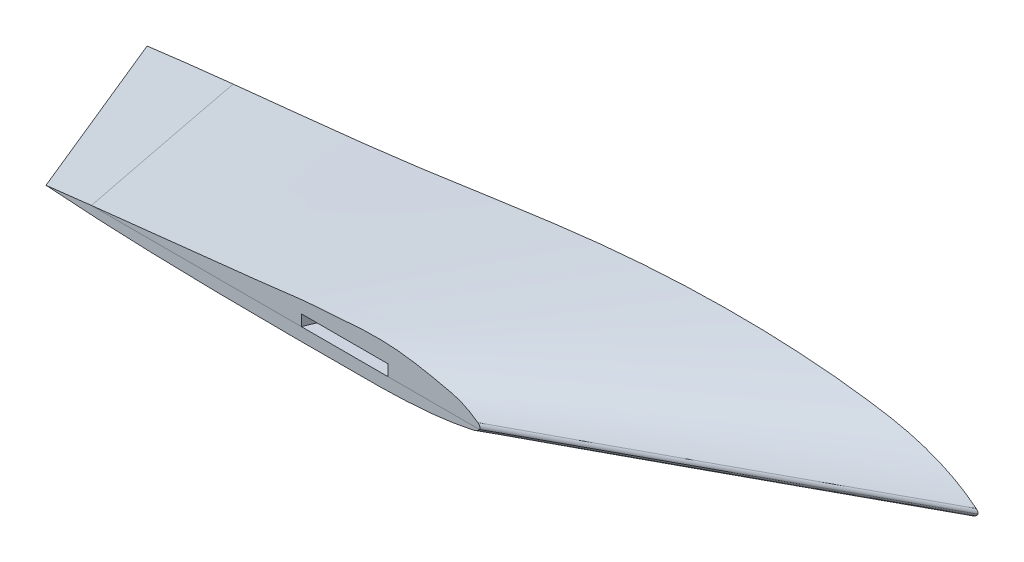
from build123d import *

# Parameters (mm, degrees)
FILLET3_R          = 6.35
CUT_EXTRUDE1_DEPTH = 5.715


with BuildPart() as part:
    # Sketch1 → Loft1 section 0
    with BuildSketch(Plane.XY):
        with BuildLine():
            add(Edge.make_bspline(
                [(-353.097115344, 3.76640622), (-263.60988857, 15.489732087), (-103.405625954, 27.702523148), (139.625383809, 69.731889132), (320.600909148, 70.897971745), (447.029350736, 49.156772515), (484.461992977, 32.39779841), (505.225432444, 13.29140622)],
                knots=[0, 0, 0, 0, 0.308401543, 0.542913332, 0.850169973, 0.887176211, 1, 1, 1, 1], degree=3))
            add(Edge.make_bspline(
                [(-353.097115344, 3.76640622), (-171.204173065, -8.622681299), (70.681231732, -17.726989966), (367.634485174, -8.589262826), (467.934967897, -1.634661846), (505.225432444, 13.29140622)],
                knots=[0, 0, 0, 0, 0.625313044, 0.861778666, 1, 1, 1, 1], degree=3))
        make_face()
    # Sketch2 → Loft1 section 1
    with BuildSketch(Plane.XY.offset(180.975)):
        with BuildLine():
            add(Edge.make_bspline(
                [(-276.130119323, 8.693130358), (-231.459725957, 13.892182525), (-160.606907467, 22.045765928), (-55.21857633, 32.848239562), (-5.484684229, 39.5878223), (20.294760191, 40.734135472), (52.215253795, 43.311195196), (77.433370096, 43.854837121), (107.657853328, 39.590984865), (131.131357877, 34.766526999), (149.499224412, 30.294140301), (163.418705178, 23.059137739), (171.530279946, 16.921852673), (175.269753602, 13.29140622)],
                knots=[0, 0, 0, 0, 0.247403676, 0.462108507, 0.504395118, 0.627983171, 0.653401948, 0.743134379, 0.818760812, 0.882434425, 0.924179622, 0.96050512, 1, 1, 1, 1], degree=3))
            add(Edge.make_bspline(
                [(-276.130119323, 8.693130358), (-174.260953063, 0.911239157), (-23.669401798, 0.683864032), (127.515095646, 0.681371654), (175.269753602, 13.29140622)],
                knots=[0, 0, 0, 0, 0.67646369, 1, 1, 1, 1], degree=3))
        make_face()
    loft()

    # Fillet3
    fillet3_edges = [part.edges().sort_by_distance(p)[0] for p in [
        (340.247593023, 13.29140622, 90.4875),
    ]]
    fillet(fillet3_edges, radius=FILLET3_R)

    # Sketch7 → Cut-Extrude1 (cut, symmetric)
    with BuildSketch(Plane(origin=(0, 19.812, 0), x_dir=(1, 0, 0), z_dir=(0, 1, 0))):
        Polygon((148.552884656, 0), (59.652884656, 0), (-13.465761565, -180.975), (75.434238435, -180.975), align=None)
    extrude(amount=CUT_EXTRUDE1_DEPTH, both=True, mode=Mode.SUBTRACT)


with BuildPart() as body_2:
    # Split1: the piece on the far side of the plane
    add(part.part)
    split(bisect_by=Plane.ZX.offset(14.097), keep=Keep.BOTTOM)


with BuildPart() as part_1:
    add(part.part)

    # Split1
    split(bisect_by=Plane.ZX.offset(14.097), keep=Keep.TOP)


solid = Compound([body_2.part, part_1.part])
